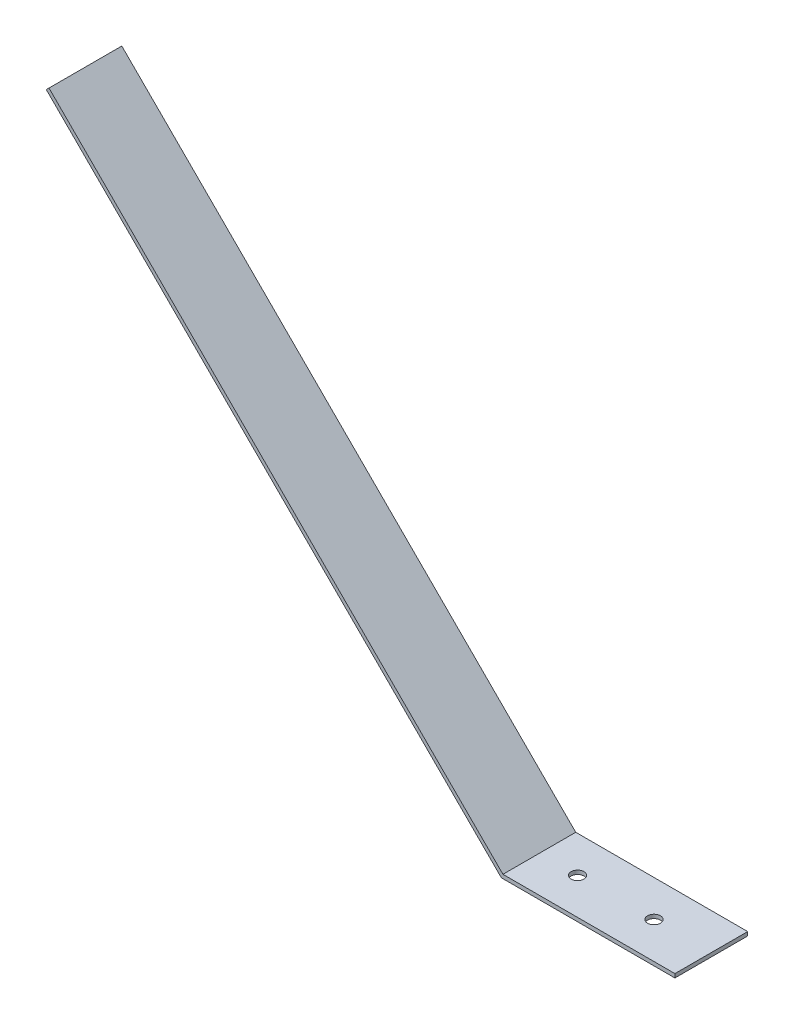
from build123d import *

# Parameters (mm, degrees)
SALIENTE_EXTRUIR1_DEPTH       = 19.05
TALADRO_DE_MARGEN_PARA_1_41_D = 6.7564


with BuildPart() as part:
    # Croquis1 → Saliente-Extruir1 (new, symmetric)
    with BuildSketch(Plane.XY):
        Polygon((0, 0), (-90, 0), (-327.587878479, 237.587878479), (-329.002092041, 236.173664916), (-90.828427125, -2), (0, -2), align=None)
    extrude(amount=SALIENTE_EXTRUIR1_DEPTH, both=True)

    # Taladro de margen para 1/41 (through all)
    with Locations(Plane(origin=(-70, 0, 0), x_dir=(1, 0, 0), z_dir=(0, 1, 0))):
        with Locations((0, 0), (40, 0)):
            Hole(TALADRO_DE_MARGEN_PARA_1_41_D / 2)


solid = part.part
